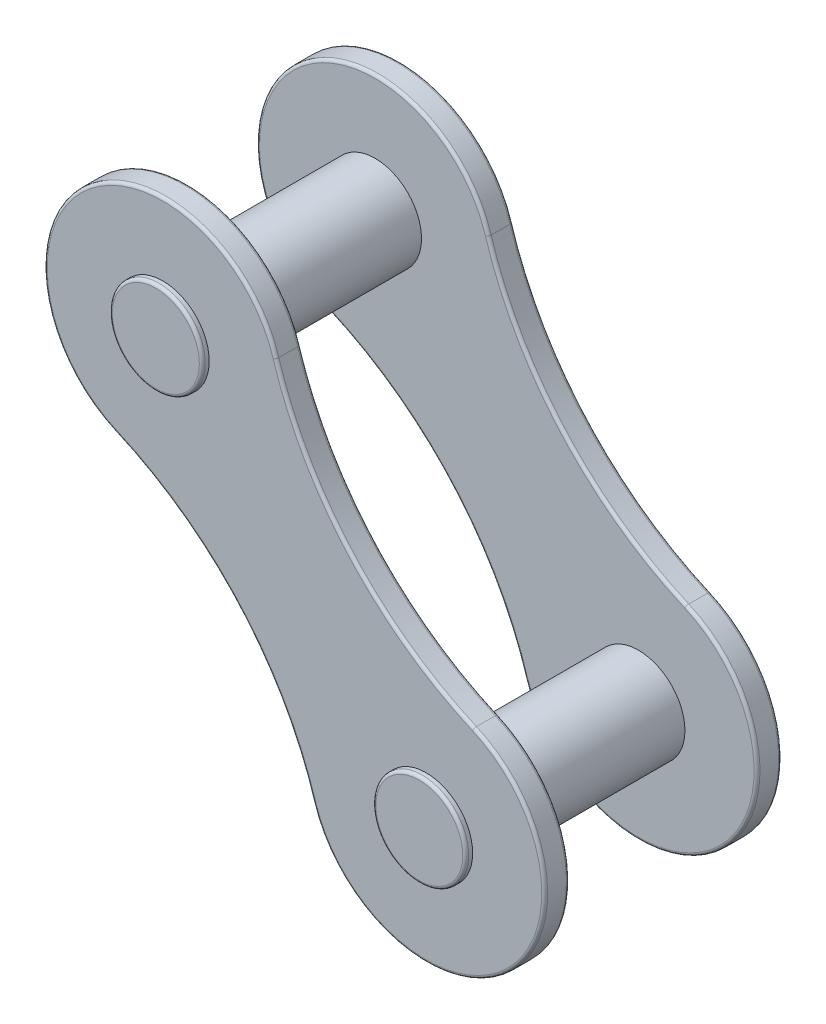
from build123d import *

# Parameters (mm, degrees)
EXTRUDE_START   = 4.75
SKETCH_7_R      = 2.35
EXTRUDE_3_DEPTH = 1.25
SKETCH_8_R      = 2.35
EXTRUDE_4_DEPTH = 6.35
FILLET_2_R      = 0.15


with BuildPart() as part:
    # Эскиз7 → Бобышка-Вытянуть3 (new body)
    with BuildSketch(Plane.XY.offset(EXTRUDE_START)):
        with BuildLine():
            ThreePointArc((52.761061598, 37.161375027), (48.978614129, 43.841392763), (42.756804195, 48.337905518))
            ThreePointArc((42.756804195, 48.337905518), (41.151776786, 58.309058261), (50.884907766, 55.613476447))
            ThreePointArc((50.884907766, 55.613476447), (54.667355235, 48.933458711), (60.889165169, 44.436945956))
            ThreePointArc((60.889165169, 44.436945956), (62.494192579, 34.465793213), (52.761061598, 37.161375027))
        make_face()
        with Locations((45.153479747, 53.838446064)):
            Circle(SKETCH_7_R, mode=Mode.SUBTRACT)
        with Locations((58.492489618, 38.936405409)):
            Circle(SKETCH_7_R, mode=Mode.SUBTRACT)
    extrude(amount=EXTRUDE_3_DEPTH)


with BuildPart() as body_2:
    # Зеркальное отражение3: mirrored copy
    add(part.part.mirror(Plane.XY))


with BuildPart() as part_1:
    add(part.part)

    add(body_2.part)  # Бобышка-Вытянуть4 merges body 2
    # Эскиз8 → Бобышка-Вытянуть4 (add, symmetric)
    with BuildSketch(Plane.XY):
        with Locations(Location((45.153479747, 53.838446064, 0), (0, 0, 180))):
            Circle(SKETCH_8_R)
        with Locations((58.492489618, 38.936405409)):
            Circle(SKETCH_8_R)
    extrude(amount=EXTRUDE_4_DEPTH, both=True)

    # Скругление2
    fillet_2_edges = [part_1.edges().sort_by_distance(p)[0] for p in [
        (41.151776786, 58.309058261, 6),
        (48.978614129, 43.841392763, 6),
        (62.494192579, 34.465793213, 6),
        (48.978614129, 43.841392763, 4.75),
        (41.151776786, 58.309058261, 4.75),
        (47.503479747, 53.838446064, -6.35),
        (47.503479747, 53.838446064, 6.35),
        (54.667355235, 48.933458711, 4.75),
        (62.494192579, 34.465793213, -4.75),
        (54.667355235, 48.933458711, -4.75),
        (41.151776786, 58.309058261, -4.75),
        (48.978614129, 43.841392763, -4.75),
        (62.494192579, 34.465793213, -6),
        (54.667355235, 48.933458711, -6),
        (41.151776786, 58.309058261, -6),
        (48.978614129, 43.841392763, -6),
        (62.494192579, 34.465793213, 4.75),
        (56.142489618, 38.936405409, -6.35),
        (56.142489618, 38.936405409, 6.35),
        (54.667355235, 48.933458711, 6),
    ]]
    fillet(fillet_2_edges, radius=FILLET_2_R)


solid = part_1.part
